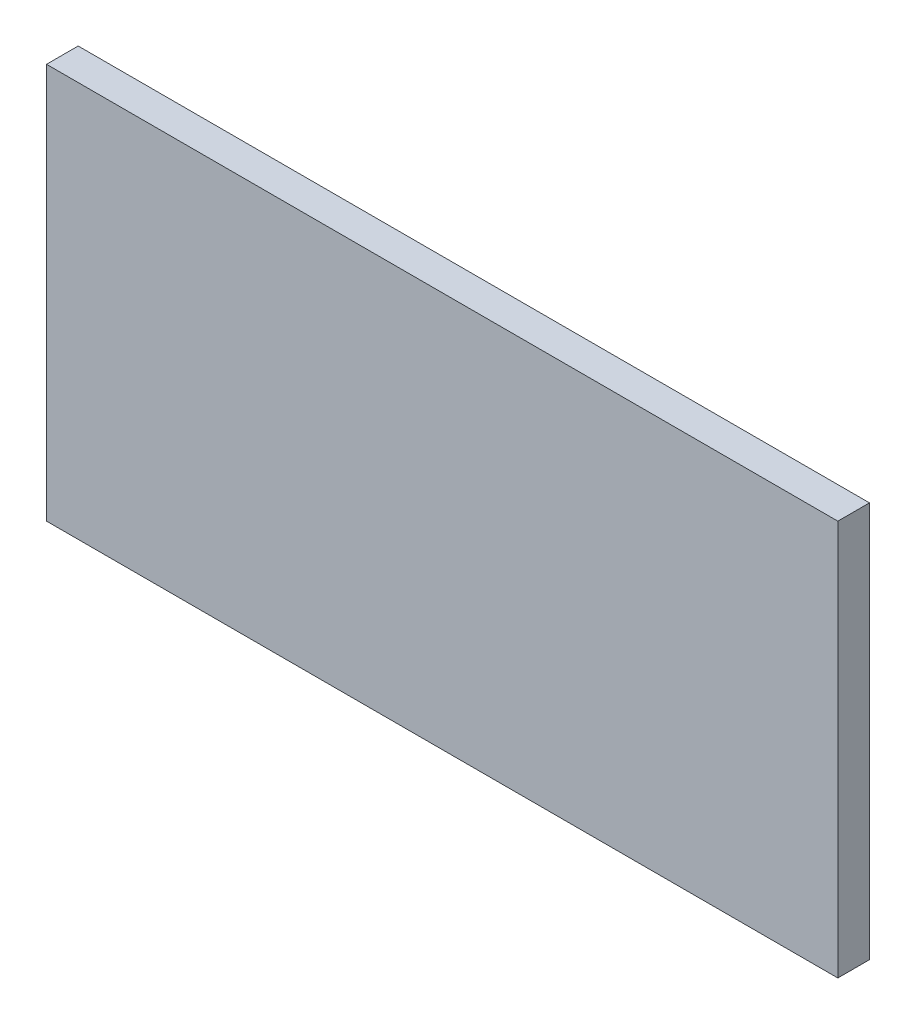
from build123d import *

# Parameters (mm, degrees)
ESBO_O1_W                = 250
ESBO_O1_H                = 125
RESSALTO_EXTRUS_O1_DEPTH = 10


with BuildPart() as part:
    # Esboço1 → Ressalto-extrusão1 (new body)
    with BuildSketch(Plane.XY):
        with Locations((0, 62.5)):
            Rectangle(ESBO_O1_W, ESBO_O1_H)
    extrude(amount=RESSALTO_EXTRUS_O1_DEPTH)


solid = part.part
